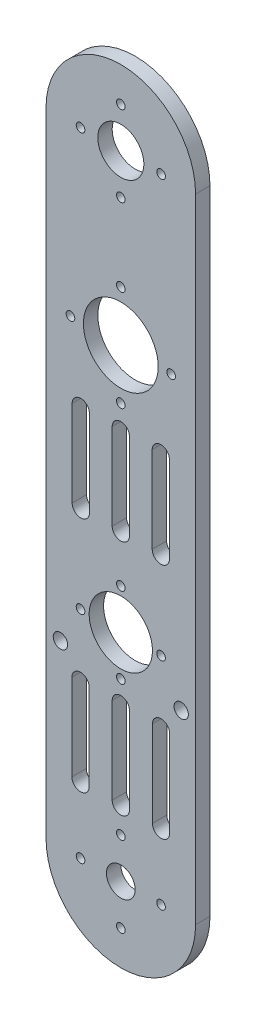
from build123d import *

# Parameters (mm, degrees)
SKETCH_1_R      = 5
SKETCH_1_R_2    = 1.5
SKETCH_1_R_3    = 8
SKETCH_1_R_4    = 2.5
SKETCH_1_R_5    = 13
SKETCH_1_R_6    = 11
EXTRUDE_1_DEPTH = 5


with BuildPart() as part:
    # 草图1 → 凸台-拉伸1 (new body)
    with BuildSketch(Plane.XY):
        with BuildLine():
            Line((-26, 220), (-26, 0))
            ThreePointArc((-26, 0), (0, -26), (26, 0))
            Line((26, 0), (26, 220))
            ThreePointArc((26, 220), (0, 246), (-26, 220))
        make_face()
        Circle(SKETCH_1_R, mode=Mode.SUBTRACT)
        with Locations((0, -14)):
            Circle(SKETCH_1_R_2, mode=Mode.SUBTRACT)
        with Locations(Location((0, 220, 0), (0, 0, 180))):
            Circle(SKETCH_1_R_3, mode=Mode.SUBTRACT)
        with Locations((-14, 0)):
            Circle(SKETCH_1_R_2, mode=Mode.SUBTRACT)
        with Locations((0, 14)):
            Circle(SKETCH_1_R_2, mode=Mode.SUBTRACT)
        with Locations((14, 0)):
            Circle(SKETCH_1_R_2, mode=Mode.SUBTRACT)
        with Locations((-21, 62)):
            Circle(SKETCH_1_R_4, mode=Mode.SUBTRACT)
        with Locations((21, 62)):
            Circle(SKETCH_1_R_4, mode=Mode.SUBTRACT)
        with Locations((0, 89)):
            Circle(SKETCH_1_R_2, mode=Mode.SUBTRACT)
        with Locations((0, 161.5)):
            Circle(SKETCH_1_R_5, mode=Mode.SUBTRACT)
        with Locations((0, 75)):
            Circle(SKETCH_1_R_6, mode=Mode.SUBTRACT)
        with Locations((0, 234)):
            Circle(SKETCH_1_R_2, mode=Mode.SUBTRACT)
        with Locations((14, 220)):
            Circle(SKETCH_1_R_2, mode=Mode.SUBTRACT)
        with Locations((0, 206)):
            Circle(SKETCH_1_R_2, mode=Mode.SUBTRACT)
        with Locations((-14, 220)):
            Circle(SKETCH_1_R_2, mode=Mode.SUBTRACT)
        with Locations((0, 179)):
            Circle(SKETCH_1_R_2, mode=Mode.SUBTRACT)
        with Locations((17.5, 161.5)):
            Circle(SKETCH_1_R_2, mode=Mode.SUBTRACT)
        with Locations((0, 144)):
            Circle(SKETCH_1_R_2, mode=Mode.SUBTRACT)
        with Locations((-17.5, 161.5)):
            Circle(SKETCH_1_R_2, mode=Mode.SUBTRACT)
        with Locations((14, 75)):
            Circle(SKETCH_1_R_2, mode=Mode.SUBTRACT)
        with Locations((0, 61)):
            Circle(SKETCH_1_R_2, mode=Mode.SUBTRACT)
        with Locations((-14, 75)):
            Circle(SKETCH_1_R_2, mode=Mode.SUBTRACT)
        with BuildLine():
            Line((-3, 105.5), (-3, 135.5))
            ThreePointArc((-3, 135.5), (0, 138.5), (3, 135.5))
            Line((3, 135.5), (3, 105.5))
            ThreePointArc((3, 105.5), (0, 102.5), (-3, 105.5))
        make_face(mode=Mode.SUBTRACT)
        with BuildLine():
            Line((-3, 23.001218935), (-3, 53.001218935))
            ThreePointArc((-3, 53.001218935), (0, 56.001218935), (3, 53.001218935))
            Line((3, 53.001218935), (3, 23.001218935))
            ThreePointArc((3, 23.001218935), (0, 20.001218935), (-3, 23.001218935))
        make_face(mode=Mode.SUBTRACT)
        with BuildLine():
            Line((-17, 23.001218935), (-17, 53.001218935))
            ThreePointArc((-17, 53.001218935), (-14, 56.001218935), (-11, 53.001218935))
            Line((-11, 53.001218935), (-11, 23.001218935))
            ThreePointArc((-11, 23.001218935), (-14, 20.001218935), (-17, 23.001218935))
        make_face(mode=Mode.SUBTRACT)
        with BuildLine():
            Line((17, 23.001218935), (17, 53.001218935))
            ThreePointArc((17, 53.001218935), (14, 56.001218935), (11, 53.001218935))
            Line((11, 53.001218935), (11, 23.001218935))
            ThreePointArc((11, 23.001218935), (14, 20.001218935), (17, 23.001218935))
        make_face(mode=Mode.SUBTRACT)
        with BuildLine():
            Line((-16.913638667, 105.5), (-16.913638667, 135.5))
            ThreePointArc((-16.913638667, 135.5), (-13.913638667, 138.5), (-10.913638667, 135.5))
            Line((-10.913638667, 135.5), (-10.913638667, 105.5))
            ThreePointArc((-10.913638667, 105.5), (-13.913638667, 102.5), (-16.913638667, 105.5))
        make_face(mode=Mode.SUBTRACT)
        with BuildLine():
            Line((16.913638667, 105.5), (16.913638667, 135.5))
            ThreePointArc((16.913638667, 135.5), (13.913638667, 138.5), (10.913638667, 135.5))
            Line((10.913638667, 135.5), (10.913638667, 105.5))
            ThreePointArc((10.913638667, 105.5), (13.913638667, 102.5), (16.913638667, 105.5))
        make_face(mode=Mode.SUBTRACT)
    extrude(amount=EXTRUDE_1_DEPTH)


solid = part.part
